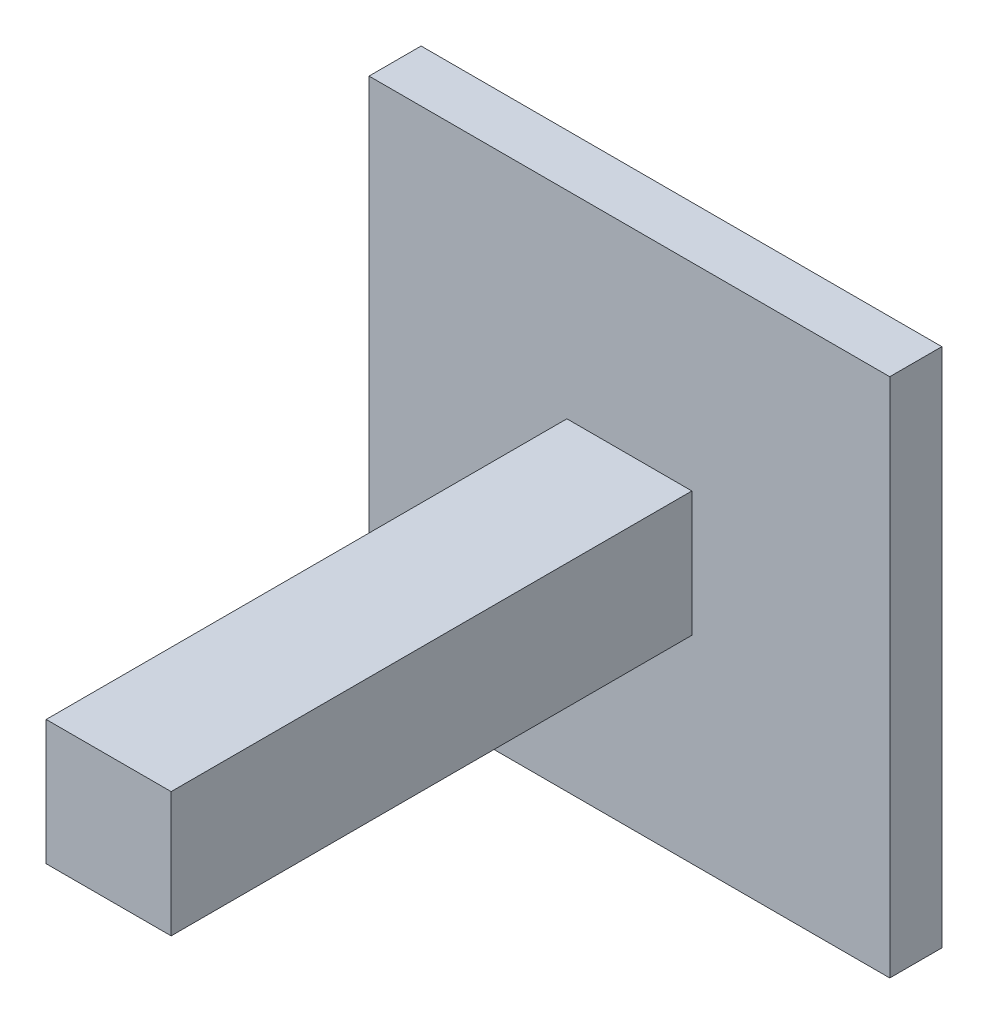
from build123d import *

# Parameters (mm, degrees)
ESQUISSE1_W          = 50
ESQUISSE1_H          = 50
BASE_EXTRUSION_DEPTH = 5
ESQUISSE2_W          = 12
ESQUISSE2_H          = 12
BOSS_EXTRU_1_DEPTH   = 50


with BuildPart() as part:
    # Esquisse1 → Base-Extrusion (new body)
    with BuildSketch(Plane.XY):
        Rectangle(ESQUISSE1_W, ESQUISSE1_H)
    extrude(amount=BASE_EXTRUSION_DEPTH)

    # Esquisse2 → Boss.-Extru.1 (add)
    with BuildSketch(Plane.XY.offset(5)):
        Rectangle(ESQUISSE2_W, ESQUISSE2_H)
    extrude(amount=BOSS_EXTRU_1_DEPTH)


solid = part.part
